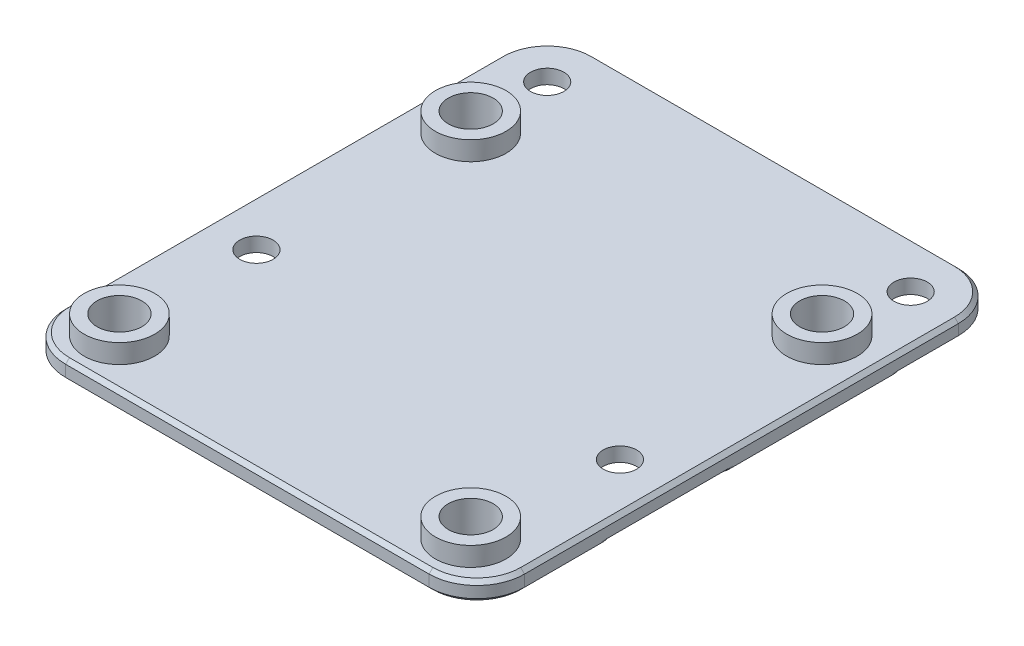
from build123d import *

# Parameters (mm, degrees)
SKETCH1_W           = 48.1
SKETCH1_H           = 55.48
SKETCH1_R           = 1.75
SKETCH1_R_2         = 2.35
BOSS_EXTRUDE1_DEPTH = 1.5
FILLET1_R           = 5
SKETCH4_R           = 3.7
SKETCH4_R_2         = 2.35
BOSS_EXTRUDE3_DEPTH = 2
BOSS_EXTRUDE4_START = 0.5
SKETCH5_R           = 2.35
BOSS_EXTRUDE4_DEPTH = 0.5
FILLET2_R           = 2
CHAMFER2_SIZE       = 0.4


with BuildPart() as part:
    # Sketch1 → Boss-Extrude1 (new body)
    with BuildSketch(Plane(origin=(0, 0, 0), x_dir=(1, 0, 0), z_dir=(0, 1, 0))):
        Rectangle(SKETCH1_W, SKETCH1_H)
        with Locations(Location((19.05, 22.74, 0), (0, 0, 270))):
            Circle(SKETCH1_R, mode=Mode.SUBTRACT)
        with Locations(Location((-19.05, 22.74, 0), (0, 0, 270))):
            Circle(SKETCH1_R, mode=Mode.SUBTRACT)
        with Locations(Location((-19.05, -7.74, 0), (0, 0, 270))):
            Circle(SKETCH1_R, mode=Mode.SUBTRACT)
        with Locations(Location((19.05, -7.74, 0), (0, 0, 270))):
            Circle(SKETCH1_R, mode=Mode.SUBTRACT)
        with Locations(Location((18.4125, -22.74, 0), (0, 0, 270))):
            Circle(SKETCH1_R_2, mode=Mode.SUBTRACT)
        with Locations(Location((-18.4125, -22.74, 0), (0, 0, 270))):
            Circle(SKETCH1_R_2, mode=Mode.SUBTRACT)
        with Locations(Location((-18.4125, 14.085, 0), (0, 0, 270))):
            Circle(SKETCH1_R_2, mode=Mode.SUBTRACT)
        with Locations(Location((18.4125, 14.085, 0), (0, 0, 270))):
            Circle(SKETCH1_R_2, mode=Mode.SUBTRACT)
    extrude(amount=BOSS_EXTRUDE1_DEPTH)

    # Fillet1
    fillet1_edges = [part.edges().sort_by_distance(p)[0] for p in [
        (24.05, 0.75, 27.74),
        (-24.05, 0.75, 27.74),
        (-24.05, 0.75, -27.74),
        (24.05, 0.75, -27.74),
    ]]
    fillet(fillet1_edges, radius=FILLET1_R)

    # Sketch4 → Boss-Extrude3 (add)
    # profile 1 of 4: a face of its own
    with BuildSketch(Plane(origin=(0, 1.5, 0), x_dir=(1, 0, 0), z_dir=(0, 1, 0))):
        with Locations(Location((-18.4125, -22.74, 0), (0, 0, 90))):
            Circle(SKETCH4_R)
        with Locations(Location((-18.4125, -22.74, 0), (0, 0, 270))):
            Circle(SKETCH4_R_2, mode=Mode.SUBTRACT)
    # profile 2 of 4: a face of its own
    with BuildSketch(Plane(origin=(0, 1.5, 0), x_dir=(1, 0, 0), z_dir=(0, 1, 0))):
        with Locations(Location((18.4125, -22.74, 0), (0, 0, 90))):
            Circle(SKETCH4_R)
        with Locations(Location((18.4125, -22.74, 0), (0, 0, 270))):
            Circle(SKETCH4_R_2, mode=Mode.SUBTRACT)
    # profile 3 of 4: a face of its own
    with BuildSketch(Plane(origin=(0, 1.5, 0), x_dir=(1, 0, 0), z_dir=(0, 1, 0))):
        with Locations(Location((18.4125, 14.085, 0), (0, 0, 90))):
            Circle(SKETCH4_R)
        with Locations(Location((18.4125, 14.085, 0), (0, 0, 270))):
            Circle(SKETCH4_R_2, mode=Mode.SUBTRACT)
    # profile 4 of 4: a face of its own
    with BuildSketch(Plane(origin=(0, 1.5, 0), x_dir=(1, 0, 0), z_dir=(0, 1, 0))):
        with Locations(Location((-18.4125, 14.085, 0), (0, 0, 90))):
            Circle(SKETCH4_R)
        with Locations(Location((-18.4125, 14.085, 0), (0, 0, 270))):
            Circle(SKETCH4_R_2, mode=Mode.SUBTRACT)
    extrude(amount=BOSS_EXTRUDE3_DEPTH)

    # Sketch5 → Boss-Extrude4 (add)
    with BuildSketch(Plane.XZ.offset(BOSS_EXTRUDE4_START)):
        with BuildLine():
            ThreePointArc((-13.55, -22.74), (-14.421172764, -25.710514841), (-16.758712153, -27.74))
            Line((-16.758712153, -27.74), (16.758712153, -27.74))
            ThreePointArc((16.758712153, -27.74), (15.160912703, -18.850912703), (24.05, -20.448712153))
            Line((24.05, -20.448712153), (24.05, 5.448712153))
            ThreePointArc((24.05, 5.448712153), (13.55, 7.74), (24.05, 10.031287847))
            Line((24.05, 10.031287847), (24.05, 22.74))
            ThreePointArc((24.05, 22.74), (22.585533906, 26.275533906), (19.05, 27.74))
            Line((19.05, 27.74), (-19.05, 27.74))
            ThreePointArc((-19.05, 27.74), (-22.585533906, 26.275533906), (-24.05, 22.74))
            Line((-24.05, 22.74), (-24.05, 10.031287847))
            ThreePointArc((-24.05, 10.031287847), (-17.87739606, 13.113546315), (-13.55, 7.74))
            ThreePointArc((-13.55, 7.74), (-17.87739606, 2.366453685), (-24.05, 5.448712153))
            Line((-24.05, 5.448712153), (-24.05, -20.448712153))
            ThreePointArc((-24.05, -20.448712153), (-17.87739606, -17.366453685), (-13.55, -22.74))
        make_face()
        with Locations(Location((-18.4125, -14.085, 0), (0, 0, 270))):
            Circle(SKETCH5_R, mode=Mode.SUBTRACT)
        with Locations(Location((18.4125, -14.085, 0), (0, 0, 270))):
            Circle(SKETCH5_R, mode=Mode.SUBTRACT)
        with Locations(Location((-18.4125, 22.74, 0), (0, 0, 270))):
            Circle(SKETCH5_R, mode=Mode.SUBTRACT)
        with Locations(Location((18.4125, 22.74, 0), (0, 0, 270))):
            Circle(SKETCH5_R, mode=Mode.SUBTRACT)
    extrude(amount=-BOSS_EXTRUDE4_DEPTH)

    # Fillet2
    fillet2_edges = [part.edges().sort_by_distance(p)[0] for p in [
        (-16.758712153, -0.25, -27.74),
        (16.758712153, -0.25, -27.74),
        (24.05, -0.25, -20.448712153),
        (24.05, -0.25, 5.448712153),
        (24.05, -0.25, 10.031287847),
        (-24.05, -0.25, 10.031287847),
        (-24.05, -0.25, 5.448712153),
        (-24.05, -0.25, -20.448712153),
    ]]
    fillet(fillet2_edges, radius=FILLET2_R)

    # Chamfer2
    chamfer2_edges = [part.edges().sort_by_distance(p)[0] for p in [
        (22.585533906, -0.5, 26.275533906),
        (0, -0.5, 27.74),
        (-22.585533906, -0.5, 26.275533906),
        (-24.05, -0.5, 18.676931771),
        (13.55, -0.5, 7.74),
        (24.05, -0.5, 18.676931771),
        (24.05, -0.5, -7.5),
        (-15.160912703, -0.5, -18.850912703),
        (0, -0.5, -27.74),
        (15.160912703, -0.5, -18.850912703),
        (-13.55, -0.5, 7.74),
        (-24.05, -0.5, -7.5),
        (-23.145445115, -0.5, 12.940543489),
        (-23.145445115, -0.5, 2.539456511),
        (-13.849456511, -0.5, -26.835445115),
        (-23.145445115, -0.5, -17.539456511),
        (23.145445115, -0.5, -17.539456511),
        (13.849456511, -0.5, -26.835445115),
        (23.145445115, -0.5, 12.940543489),
        (23.145445115, -0.5, 2.539456511),
        (0, 1.5, -27.74),
        (-24.05, 0, -19.303068229),
        (-22.585533906, 0, -26.275533906),
        (24.05, 1.5, 0),
        (-24.05, 1.5, 0),
        (0, 1.5, 27.74),
        (-22.585533906, 1.5, -26.275533906),
        (-22.585533906, 1.5, 26.275533906),
        (22.585533906, 1.5, 26.275533906),
        (22.585533906, 1.5, -26.275533906),
        (-15.613068229, 0, -27.74),
        (-24.05, 0, 7.74),
    ]]
    chamfer(chamfer2_edges, length=CHAMFER2_SIZE)


solid = part.part
